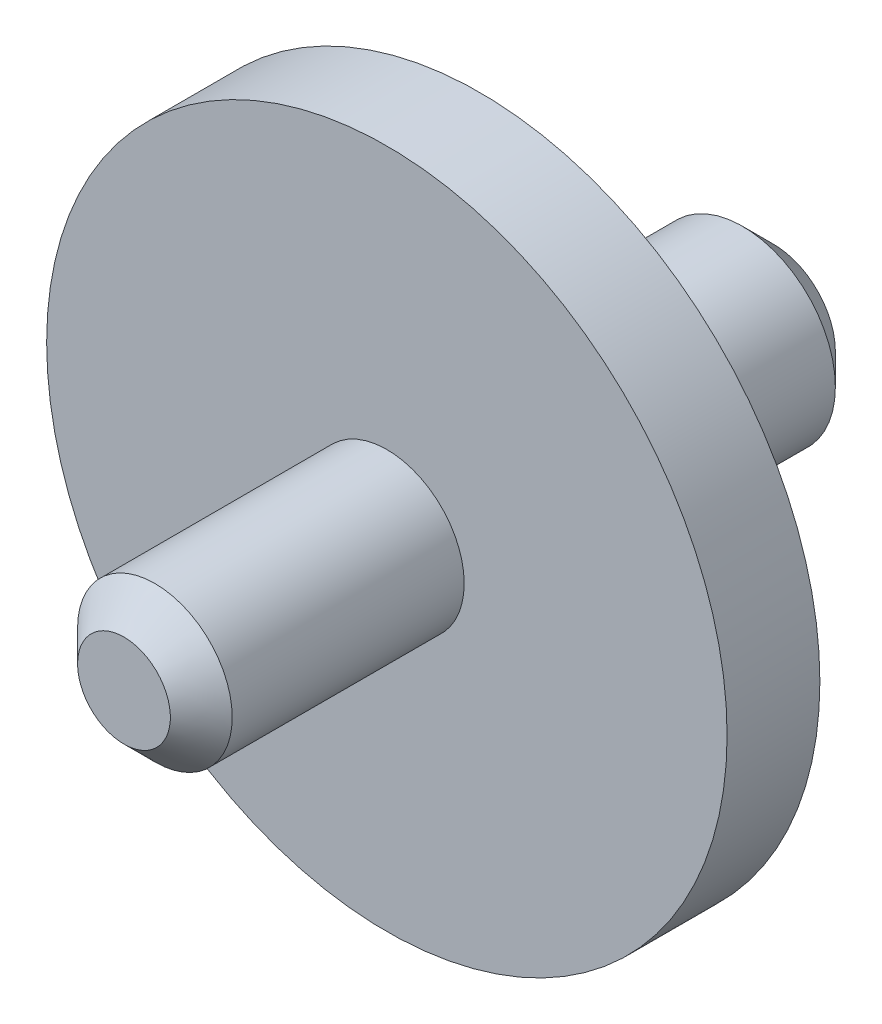
from build123d import *

# Parameters (mm, degrees)
CHAMFER1_SIZE = 1


with BuildPart() as part:
    # Sketch1 → Revolve1 (revolve)
    with BuildSketch(Plane(origin=(0, 0, 0), x_dir=(0, 0, -1), z_dir=(1, 0, 0)), mode=Mode.PRIVATE) as revolve1_sk:
        Polygon((0, 0), (0, 2.5), (8.5, 2.5), (8.5, 11), (11.5, 11), (11.5, 5), (15.5, 5), (15.5, 3), (21, 3), (21, 0), align=None)
    revolve(revolve1_sk.sketch.rotate(Axis((0, 0, 41.619499546), (0, 0, -1)), 90), axis=Axis((0, 0, 41.619499546), (0, 0, -1)))

    # Chamfer1
    chamfer1_edges = [part.edges().sort_by_distance(p)[0] for p in [
        (-2.5, 0, 0),
        (-3, 0, -21),
    ]]
    chamfer(chamfer1_edges, length=CHAMFER1_SIZE)


solid = part.part
